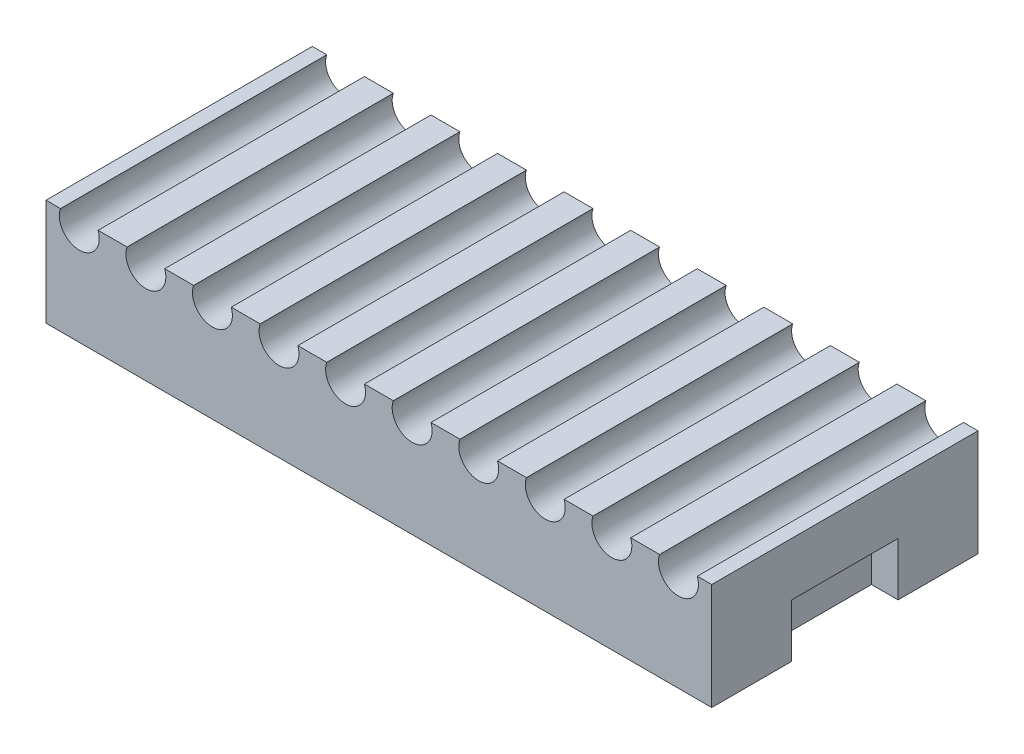
from build123d import *

# Parameters (mm, degrees)
SKETCH1_W           = 25
SKETCH1_H           = 4
BOSS_EXTRUDE1_DEPTH = 10
SKETCH2_R           = 0.75
CUT_EXTRUDE1_DEPTH  = 17.132265805
SKETCH4_W           = 4
SKETCH4_H           = 2
CUT_EXTRUDE2_DEPTH  = 1


with BuildPart() as part:
    # Sketch1 → Boss-Extrude1 (new body)
    with BuildSketch(Plane.XY):
        Rectangle(SKETCH1_W, SKETCH1_H)
    extrude(amount=BOSS_EXTRUDE1_DEPTH)

    # Sketch2 → Cut-Extrude1 (cut, through all)
    with BuildSketch(Plane(origin=(0, 0, 0), x_dir=(-1, 0, 0), z_dir=(0, 0, -1))):
        with Locations((-11.25, 1.75)):
            Circle(SKETCH2_R)
        with Locations((-8.75, 1.75)):
            Circle(SKETCH2_R)
        with Locations((-6.25, 1.75)):
            Circle(SKETCH2_R)
        with Locations((-3.75, 1.75)):
            Circle(SKETCH2_R)
        with Locations((-1.25, 1.75)):
            Circle(SKETCH2_R)
        with Locations((1.25, 1.75)):
            Circle(SKETCH2_R)
        with Locations((3.75, 1.75)):
            Circle(SKETCH2_R)
        with Locations((6.25, 1.75)):
            Circle(SKETCH2_R)
        with Locations((8.75, 1.75)):
            Circle(SKETCH2_R)
        with Locations((11.25, 1.75)):
            Circle(SKETCH2_R)
    extrude(amount=-CUT_EXTRUDE1_DEPTH, mode=Mode.SUBTRACT)

    # Sketch4 → Cut-Extrude2 (cut)
    with BuildSketch(Plane(origin=(12.5, 0, 0), x_dir=(0, 0, -1), z_dir=(1, 0, 0))):
        with Locations((-5, -1)):
            Rectangle(SKETCH4_W, SKETCH4_H)
    cut_extrude2 = extrude(amount=-CUT_EXTRUDE2_DEPTH, mode=Mode.SUBTRACT)

    # Mirror1: Cut-Extrude2 across plane
    add(cut_extrude2.mirror(Plane(origin=(0, 0, 0), x_dir=(0, 0, 1), z_dir=(1, 0, 0))), mode=Mode.SUBTRACT)


solid = part.part
